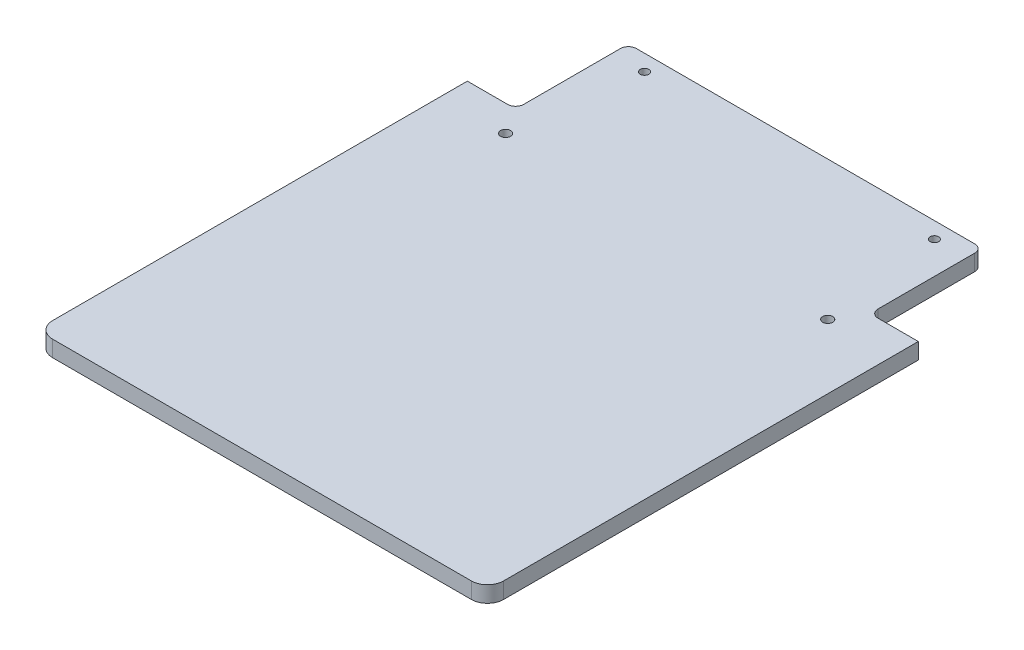
from build123d import *

# Parameters (mm, degrees)
SKETCH1_W                      = 355.6
SKETCH1_H                      = 428.625
BOSS_EXTRUDE1_DEPTH            = 12.7
FILLET1_R                      = 12.7
SKETCH3_W                      = 38.1
SKETCH3_H                      = 88.9
CUT_EXTRUDE2_DEPTH             = 558.074537764
FILLET2_R                      = 6.35
H_0_266_DIAMETER_HOLE1_D       = 6.7564
F_5_16_0_3125_DIAMETER_HOLE1_D = 7.9375


with BuildPart() as part:
    # Sketch1 → Boss-Extrude1 (new body)
    with BuildSketch(Plane(origin=(0, 0, 0), x_dir=(1, 0, 0), z_dir=(0, 1, 0))):
        with Locations((177.8, 214.3125)):
            Rectangle(SKETCH1_W, SKETCH1_H)
    extrude(amount=BOSS_EXTRUDE1_DEPTH)

    # Fillet1
    fillet1_edges = [part.edges().sort_by_distance(p)[0] for p in [
        (355.6, 6.35, 0),
        (0, 6.35, 0),
    ]]
    fillet(fillet1_edges, radius=FILLET1_R)

    # Sketch3 → Cut-Extrude2 (cut, through all)
    with BuildSketch(Plane(origin=(0, 12.7, 0), x_dir=(1, 0, 0), z_dir=(0, 1, 0))):
        with Locations((19.05, 384.175)):
            Rectangle(SKETCH3_W, SKETCH3_H)
        with Locations((336.55, 384.175)):
            Rectangle(SKETCH3_W, SKETCH3_H)
    extrude(amount=-CUT_EXTRUDE2_DEPTH, mode=Mode.SUBTRACT)

    # Fillet2
    fillet2_edges = [part.edges().sort_by_distance(p)[0] for p in [
        (38.1, 6.35, -428.625),
        (38.1, 6.35, -339.725),
        (317.5, 6.35, -428.625),
        (317.5, 6.35, -339.725),
    ]]
    fillet(fillet2_edges, radius=FILLET2_R)

    # H (0.266) Diameter Hole1 (through all)
    with Locations(Plane(origin=(0, 12.7, 0), x_dir=(1, 0, 0), z_dir=(0, 1, 0))):
        with Locations((63.5, 415.925), (292.1, 415.925)):
            Hole(H_0_266_DIAMETER_HOLE1_D / 2)

    # 5/16 (0.3125) Diameter Hole1 (through all)
    with Locations(Plane(origin=(0, 0, 0), x_dir=(-1, 0, 0), z_dir=(0, -1, 0))):
        with Locations((-50.8, 319.0875), (-304.8, 319.0875)):
            Hole(F_5_16_0_3125_DIAMETER_HOLE1_D / 2)


solid = part.part
